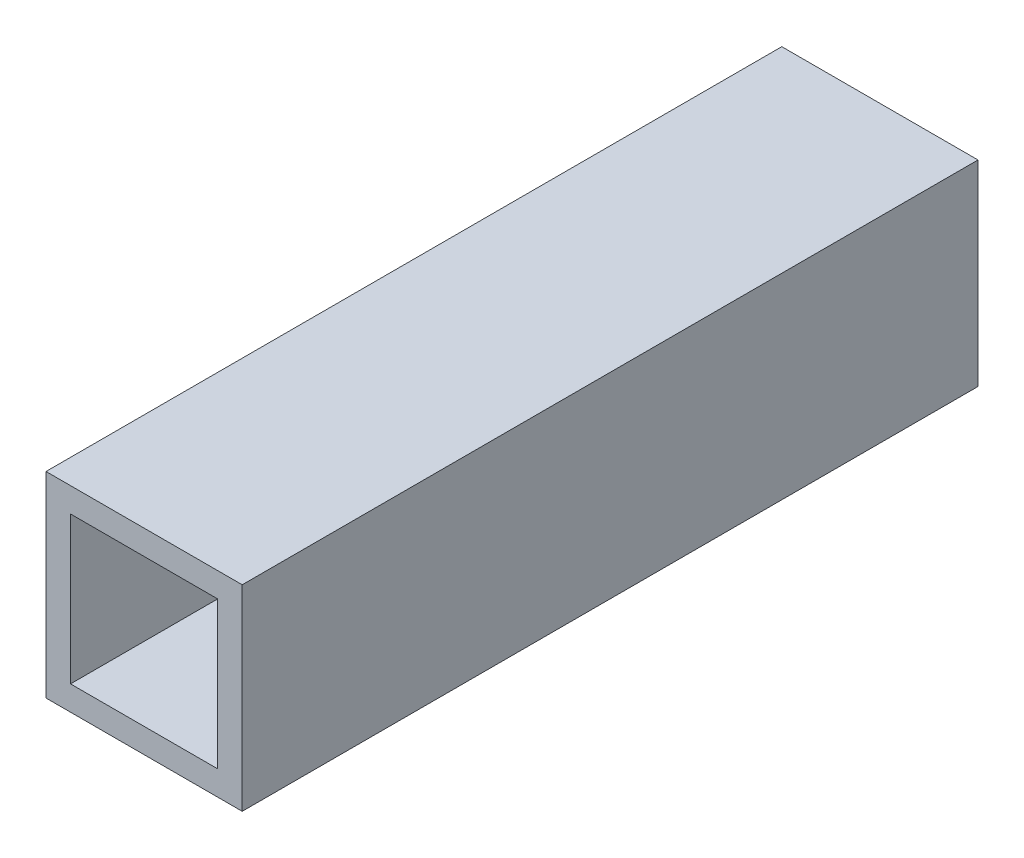
from build123d import *

# Parameters (mm, degrees)
SKETCH1_W           = 25.4
SKETCH1_H           = 25.4
SKETCH1_W_2         = 19.05
SKETCH1_H_2         = 19.05
BOSS_EXTRUDE1_DEPTH = 95.25


with BuildPart() as part:
    # Sketch1 → Boss-Extrude1 (new body)
    with BuildSketch(Plane.XY):
        Rectangle(SKETCH1_W, SKETCH1_H)
        Rectangle(SKETCH1_W_2, SKETCH1_H_2, mode=Mode.SUBTRACT)
    extrude(amount=BOSS_EXTRUDE1_DEPTH)


solid = part.part
